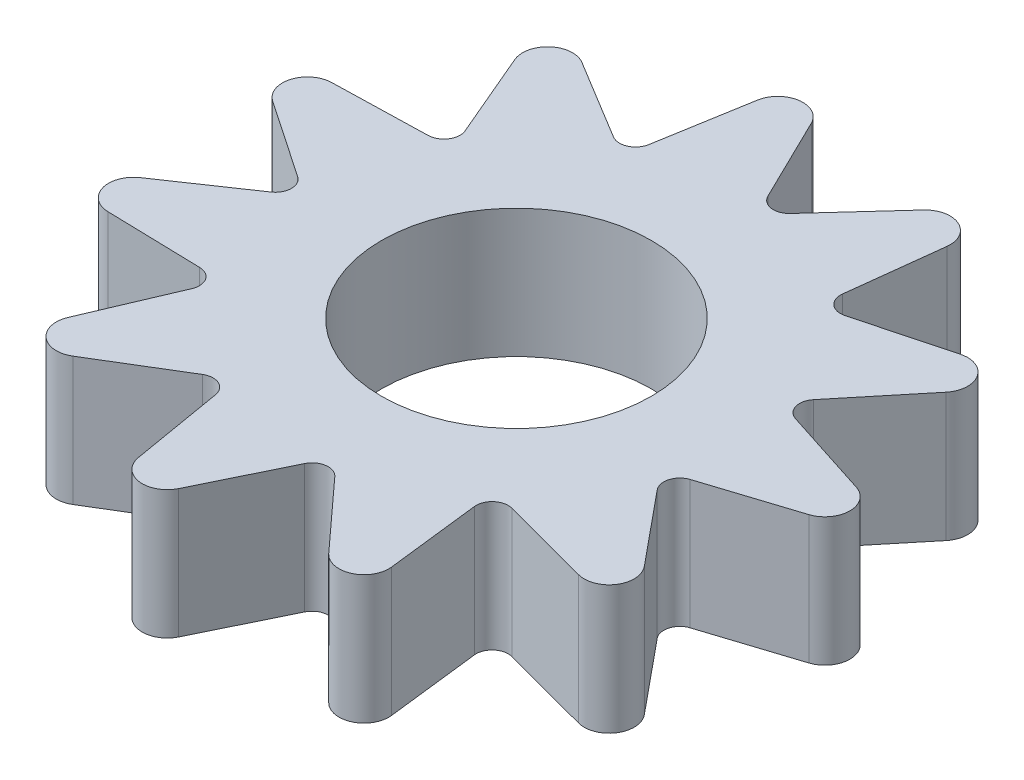
from build123d import *

# Parameters (mm, degrees)
SKETCH1_R           = 3.5014085
SKETCH1_R_2         = 2.1
BOSS_EXTRUDE3_DEPTH = 2


with BuildPart() as part:
    # Sketch1 → Boss-Extrude3 (new body)
    # profile 1 of 12: a face of its own
    with BuildSketch(Plane(origin=(0, 0, 0), x_dir=(1, 0, 0), z_dir=(0, 1, 0))):
        with BuildLine():
            ThreePointArc((-3.5014085, 0), (-3.359576854, 0.986460769), (-2.945572271, 1.893004354))
            ThreePointArc((-2.945572271, 1.893004354), (-3.033257635, 1.810305959), (-3.149447141, 1.778247481))
            Line((-3.149447141, 1.778247481), (-4.615566287, 1.740476447))
            ThreePointArc((-4.615566287, 1.740476447), (-4.978126808, 1.461709916), (-4.823834054, 1.03118157))
            Line((-4.823834054, 1.03118157), (-3.610876706, 0.206762702))
            ThreePointArc((-3.610876706, 0.206762702), (-3.530463995, 0.116976603), (-3.5014085, 0))
        make_face()
    # profile 2 of 12: a face of its own
    with BuildSketch(Plane(origin=(0, 0, 0), x_dir=(1, 0, 0), z_dir=(0, 1, 0))):
        with BuildLine():
            ThreePointArc((-2.945572271, 1.893004354), (-2.29293494, 2.646187984), (-1.454537658, 3.1849932))
            ThreePointArc((-1.454537658, 3.1849932), (-1.573013407, 3.162829171), (-1.688090363, 3.198676652))
            Line((-1.688090363, 3.198676652), (-2.941888835, 3.95954549))
            ThreePointArc((-2.941888835, 3.95954549), (-3.39760672, 3.921047178), (-3.500568593, 3.475446725))
            Line((-3.500568593, 3.475446725), (-2.925878429, 2.126127187))
            ThreePointArc((-2.925878429, 2.126127187), (-2.906772982, 2.007119921), (-2.945572271, 1.893004354))
        make_face()
    # profile 3 of 12: a face of its own
    with BuildSketch(Plane(origin=(0, 0, 0), x_dir=(1, 0, 0), z_dir=(0, 1, 0))):
        with BuildLine():
            ThreePointArc((-1.454537658, 3.1849932), (-0.498302384, 3.46576921), (0.498302384, 3.46576921))
            ThreePointArc((0.498302384, 3.46576921), (0.386651462, 3.511176468), (0.309223179, 3.603548588))
            Line((0.309223179, 3.603548588), (-0.334182465, 4.921486817))
            ThreePointArc((-0.334182465, 4.921486817), (-0.738370505, 5.135479665), (-1.065897337, 4.816282101))
            Line((-1.065897337, 4.816282101), (-1.311934425, 3.370461313))
            ThreePointArc((-1.311934425, 3.370461313), (-1.360202085, 3.260016845), (-1.454537658, 3.1849932))
        make_face()
    # profile 4 of 12: a face of its own
    with BuildSketch(Plane(origin=(0, 0, 0), x_dir=(1, 0, 0), z_dir=(0, 1, 0))):
        with BuildLine():
            ThreePointArc((0.498302384, 3.46576921), (1.454537658, 3.1849932), (2.29293494, 2.646187984))
            ThreePointArc((2.29293494, 2.646187984), (2.223557225, 2.744750046), (2.208360546, 2.864319308))
            Line((2.208360546, 2.864319308), (2.379624476, 4.320890853))
            ThreePointArc((2.379624476, 4.320890853), (2.155293128, 4.719433645), (1.707188792, 4.62798194))
            Line((1.707188792, 4.62798194), (0.71853949, 3.544697787))
            ThreePointArc((0.71853949, 3.544697787), (0.618223363, 3.477881456), (0.498302384, 3.46576921))
        make_face()
    # profile 5 of 12: a face of its own
    with BuildSketch(Plane(origin=(0, 0, 0), x_dir=(1, 0, 0), z_dir=(0, 1, 0))):
        with BuildLine():
            ThreePointArc((2.29293494, 2.646187984), (2.945572271, 1.893004354), (3.359576854, 0.986460769))
            ThreePointArc((3.359576854, 0.986460769), (3.354499279, 1.106884877), (3.406359043, 1.215688886))
            Line((3.406359043, 1.215688886), (4.33791746, 2.348442573))
            ThreePointArc((4.33791746, 2.348442573), (4.364666422, 2.805000788), (3.938254542, 2.970330213))
            Line((3.938254542, 2.970330213), (2.520882193, 2.593517759))
            ThreePointArc((2.520882193, 2.593517759), (2.400367261, 2.591543277), (2.29293494, 2.646187984))
        make_face()
    # profile 6 of 12: a face of its own
    with BuildSketch(Plane(origin=(0, 0, 0), x_dir=(1, 0, 0), z_dir=(0, 1, 0))):
        with BuildLine():
            Line((4.918952301, 0.369619631), (3.522862612, 0.818914167))
            ThreePointArc((3.522862612, 0.818914167), (3.420411514, 0.882408419), (3.359576854, 0.986460769))
            ThreePointArc((3.359576854, 0.986460769), (3.46576921, 0.498302384), (3.5014085, 0))
            ThreePointArc((3.5014085, 0), (3.46576921, -0.498302384), (3.359576854, -0.986460769))
            ThreePointArc((3.359576854, -0.986460769), (3.420411514, -0.882408419), (3.522862612, -0.818914167))
            Line((3.522862612, -0.818914167), (4.918952301, -0.369619631))
            ThreePointArc((4.918952301, -0.369619631), (5.188288966, 0), (4.918952301, 0.369619631))
        make_face()
    # profile 7 of 12: a face of its own
    with BuildSketch(Plane(origin=(0, 0, 0), x_dir=(1, 0, 0), z_dir=(0, 1, 0))):
        with BuildLine():
            ThreePointArc((3.406359043, -1.215688886), (3.354499279, -1.106884877), (3.359576854, -0.986460769))
            ThreePointArc((3.359576854, -0.986460769), (2.945572271, -1.893004354), (2.29293494, -2.646187984))
            ThreePointArc((2.29293494, -2.646187984), (2.400367261, -2.591543277), (2.520882193, -2.593517759))
            Line((2.520882193, -2.593517759), (3.938254542, -2.970330213))
            ThreePointArc((3.938254542, -2.970330213), (4.364666422, -2.805000788), (4.33791746, -2.348442573))
            Line((4.33791746, -2.348442573), (3.406359043, -1.215688886))
        make_face()
    # profile 8 of 12: a face of its own
    with BuildSketch(Plane(origin=(0, 0, 0), x_dir=(1, 0, 0), z_dir=(0, 1, 0))):
        with BuildLine():
            ThreePointArc((2.208360546, -2.864319308), (2.223557225, -2.744750046), (2.29293494, -2.646187984))
            ThreePointArc((2.29293494, -2.646187984), (1.454537658, -3.1849932), (0.498302384, -3.46576921))
            ThreePointArc((0.498302384, -3.46576921), (0.618223363, -3.477881456), (0.71853949, -3.544697787))
            Line((0.71853949, -3.544697787), (1.707188792, -4.62798194))
            ThreePointArc((1.707188792, -4.62798194), (2.155293128, -4.719433645), (2.379624476, -4.320890853))
            Line((2.379624476, -4.320890853), (2.208360546, -2.864319308))
        make_face()
    # profile 9 of 12: a face of its own
    with BuildSketch(Plane(origin=(0, 0, 0), x_dir=(1, 0, 0), z_dir=(0, 1, 0))):
        with BuildLine():
            ThreePointArc((0.309223179, -3.603548588), (0.386651462, -3.511176468), (0.498302384, -3.46576921))
            ThreePointArc((0.498302384, -3.46576921), (-0.498302384, -3.46576921), (-1.454537658, -3.1849932))
            ThreePointArc((-1.454537658, -3.1849932), (-1.360202085, -3.260016845), (-1.311934425, -3.370461313))
            Line((-1.311934425, -3.370461313), (-1.065897337, -4.816282101))
            ThreePointArc((-1.065897337, -4.816282101), (-0.738370505, -5.135479665), (-0.334182465, -4.921486817))
            Line((-0.334182465, -4.921486817), (0.309223179, -3.603548588))
        make_face()
    # profile 10 of 12: a face of its own
    with BuildSketch(Plane(origin=(0, 0, 0), x_dir=(1, 0, 0), z_dir=(0, 1, 0))):
        with BuildLine():
            ThreePointArc((-1.688090363, -3.198676652), (-1.573013407, -3.162829171), (-1.454537658, -3.1849932))
            ThreePointArc((-1.454537658, -3.1849932), (-2.29293494, -2.646187984), (-2.945572271, -1.893004354))
            ThreePointArc((-2.945572271, -1.893004354), (-2.906772982, -2.007119921), (-2.925878429, -2.126127187))
            Line((-2.925878429, -2.126127187), (-3.500568593, -3.475446725))
            ThreePointArc((-3.500568593, -3.475446725), (-3.39760672, -3.921047178), (-2.941888835, -3.95954549))
            Line((-2.941888835, -3.95954549), (-1.688090363, -3.198676652))
        make_face()
    # profile 11 of 12: a face of its own
    with BuildSketch(Plane(origin=(0, 0, 0), x_dir=(1, 0, 0), z_dir=(0, 1, 0))):
        with BuildLine():
            ThreePointArc((-2.945572271, -1.893004354), (-3.359576854, -0.986460769), (-3.5014085, 0))
            ThreePointArc((-3.5014085, 0), (-3.530463995, -0.116976603), (-3.610876706, -0.206762702))
            Line((-3.610876706, -0.206762702), (-4.823834054, -1.03118157))
            ThreePointArc((-4.823834054, -1.03118157), (-4.978126808, -1.461709916), (-4.615566287, -1.740476447))
            Line((-4.615566287, -1.740476447), (-3.149447141, -1.778247481))
            ThreePointArc((-3.149447141, -1.778247481), (-3.033257635, -1.810305959), (-2.945572271, -1.893004354))
        make_face()
    # profile 12 of 12: a face of its own
    with BuildSketch(Plane(origin=(0, 0, 0), x_dir=(1, 0, 0), z_dir=(0, 1, 0))):
        Circle(SKETCH1_R)
        with Locations(Location((0, 0, 0), (0, 0, 270))):
            Circle(SKETCH1_R_2, mode=Mode.SUBTRACT)
    extrude(amount=BOSS_EXTRUDE3_DEPTH)


solid = part.part
